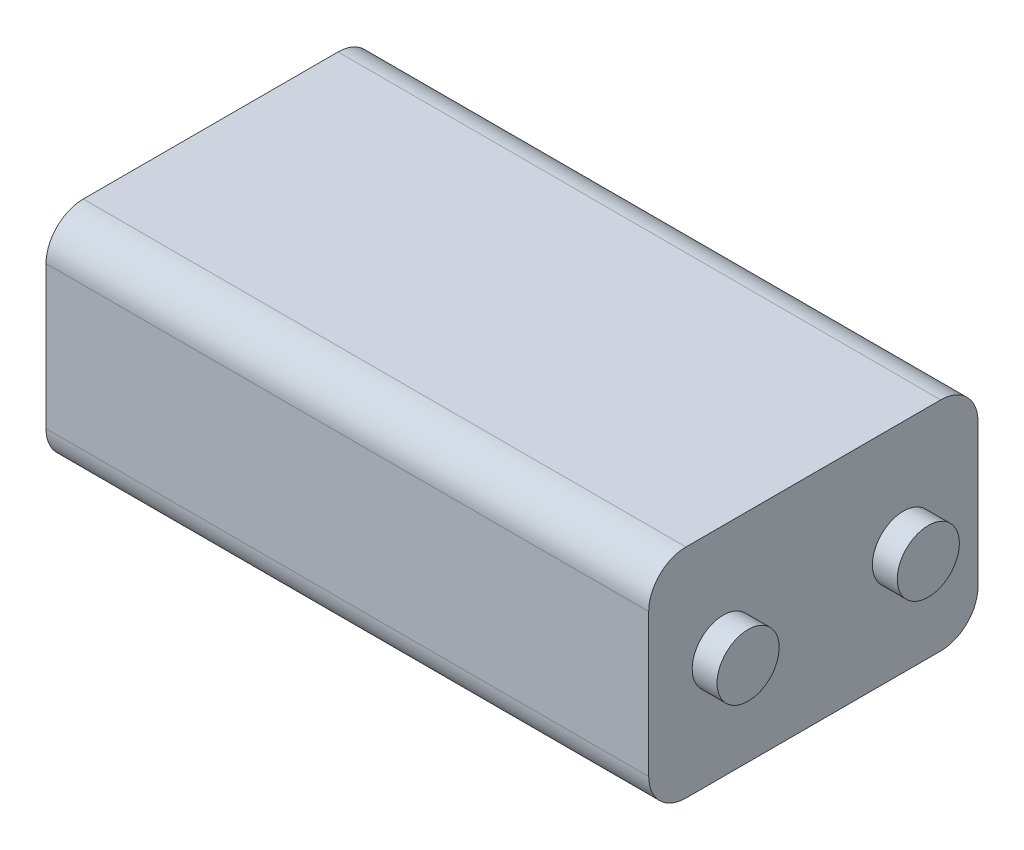
from build123d import *

# Parameters (mm, degrees)
SKETCH_1_W      = 48.5
SKETCH_1_H      = 17.5
EXTRUDE_1_DEPTH = 26.5
FILLET_1_R      = 3
SKETCH_2_R      = 2.5
EXTRUDE_2_DEPTH = 2


with BuildPart() as part:
    # ｽｹｯﾁ1 → ﾎﾞｽ - 押し出し1 (new body)
    with BuildSketch(Plane.XY):
        Rectangle(SKETCH_1_W, SKETCH_1_H)
    extrude(amount=EXTRUDE_1_DEPTH)

    # ﾌｨﾚｯﾄ1
    fillet_1_edges = [part.edges().sort_by_distance(p)[0] for p in [
        (0, -8.75, 26.5),
        (0, -8.75, 0),
        (0, 8.75, 0),
        (0, 8.75, 26.5),
    ]]
    fillet(fillet_1_edges, radius=FILLET_1_R)

    # ｽｹｯﾁ2 → ﾎﾞｽ - 押し出し2 (add)
    with BuildSketch(Plane(origin=(24.25, 0, 0), x_dir=(0, 0, -1), z_dir=(1, 0, 0))):
        with Locations(Location((-20.5, 0, 0), (0, 0, 270))):
            Circle(SKETCH_2_R)
        with Locations(Location((-6, 0, 0), (0, 0, 270))):
            Circle(SKETCH_2_R)
    extrude(amount=EXTRUDE_2_DEPTH)


solid = part.part
